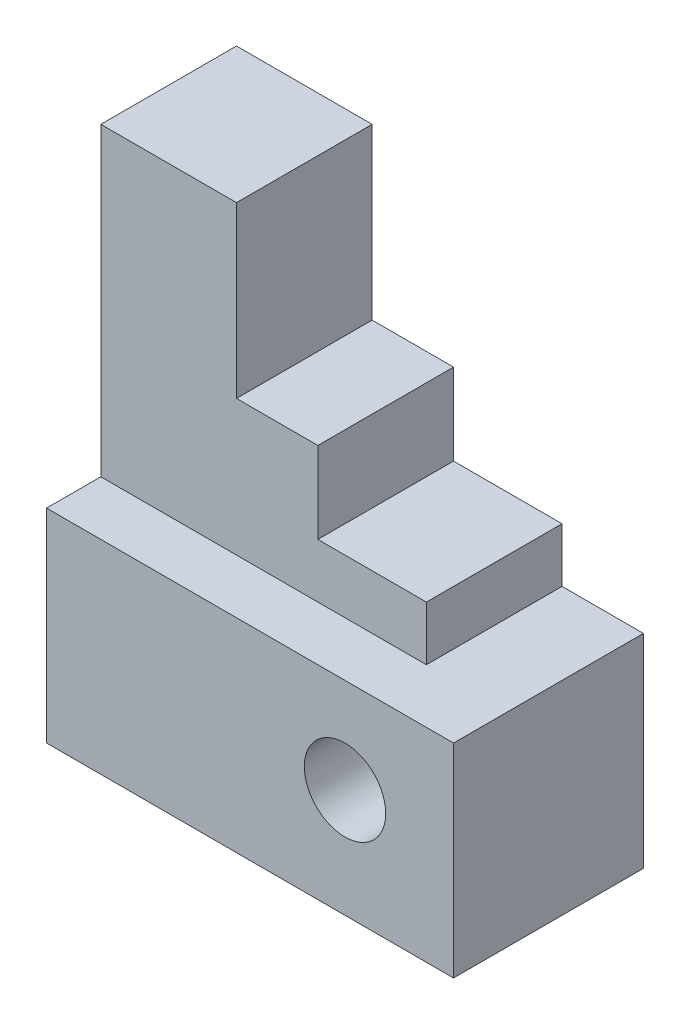
from build123d import *

# Parameters (mm, degrees)
BOSS_EXTRUDE1_DEPTH = 30
SKETCH1_3_W         = 20
SKETCH1_3_H         = 20
BOSS_EXTRUDE2_DEPTH = 75
SKETCH1_4_W         = 12
SKETCH1_4_H         = 20
BOSS_EXTRUDE3_DEPTH = 50
SKETCH1_5_W         = 16
SKETCH1_5_H         = 20
BOSS_EXTRUDE4_DEPTH = 38
SKETCH3_R           = 6
CUT_EXTRUDE1_DEPTH  = 28


with BuildPart() as part:
    # Sketch1 → Boss-Extrude1 (new body)
    with BuildSketch(Plane(origin=(0, 0, 0), x_dir=(1, 0, 0), z_dir=(0, 1, 0))):
        Polygon((11.295242974, -8.482888911), (-0.704757026, -8.482888911), (-20.704757026, -8.482888911), (-20.704757026, -16.482888911), (39.295242974, -16.482888911), (39.295242974, 11.517111089), (27.295242974, 11.517111089), (27.295242974, -8.482888911), align=None)
    extrude(amount=BOSS_EXTRUDE1_DEPTH)

    # Sketch1<3> → Boss-Extrude2 (add)
    with BuildSketch(Plane(origin=(0, 0, 0), x_dir=(1, 0, 0), z_dir=(0, 1, 0))):
        with Locations((-10.704757026, 1.517111089)):
            Rectangle(SKETCH1_3_W, SKETCH1_3_H)
    extrude(amount=BOSS_EXTRUDE2_DEPTH)

    # Sketch1<4> → Boss-Extrude3 (add)
    with BuildSketch(Plane(origin=(0, 0, 0), x_dir=(1, 0, 0), z_dir=(0, 1, 0))):
        with Locations((5.295242974, 1.517111089)):
            Rectangle(SKETCH1_4_W, SKETCH1_4_H)
    extrude(amount=BOSS_EXTRUDE3_DEPTH)

    # Sketch1<5> → Boss-Extrude4 (add)
    with BuildSketch(Plane(origin=(0, 0, 0), x_dir=(1, 0, 0), z_dir=(0, 1, 0))):
        with Locations((19.295242974, 1.517111089)):
            Rectangle(SKETCH1_5_W, SKETCH1_5_H)
    extrude(amount=BOSS_EXTRUDE4_DEPTH)

    # Sketch3 → Cut-Extrude1 (cut)
    with BuildSketch(Plane.XY.offset(16.482888911)):
        with Locations((23.295242974, 16)):
            Circle(SKETCH3_R)
    extrude(amount=-CUT_EXTRUDE1_DEPTH, mode=Mode.SUBTRACT)


solid = part.part
